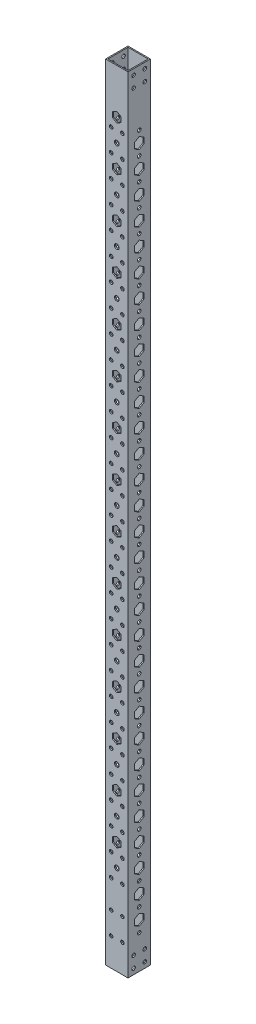
from build123d import *

# Parameters (mm, degrees)
SKETCH_1_W          = 20
SKETCH_1_H          = 20
SKETCH_1_W_2        = 18
SKETCH_1_H_2        = 18
EXTRUDE_1_DEPTH     = 700
SKETCH_3_R          = 1.55
SKETCH_3_R_2        = 2.1
SKETCH_3_R_3        = 1.6
CUT_EXTRUDE_2_DEPTH = 701.357051796
SKETCH_4_R          = 1.6
CUT_EXTRUDE_3_DEPTH = 701.357051796
SKETCH_5_R          = 1.6
CUT_EXTRUDE_4_DEPTH = 701.357051796


with BuildPart() as part:
    # 草图1 → 拉伸-薄壁1 (new body)
    with BuildSketch(Plane(origin=(0, 0, 0), x_dir=(1, 0, 0), z_dir=(0, 1, 0))):
        Rectangle(SKETCH_1_W, SKETCH_1_H)
        Rectangle(SKETCH_1_W_2, SKETCH_1_H_2, mode=Mode.SUBTRACT)
    extrude(amount=EXTRUDE_1_DEPTH)

    # 草图3 → 切除-拉伸2 (cut, through all)
    with BuildSketch(Plane(origin=(0, 0, 10), x_dir=(-1, 0, 0), z_dir=(0, 0, -1))):
        with Locations((-5, 25)):
            Circle(SKETCH_3_R)
        with Locations(Location((-5, 45, 0), (0, 0, 180))):
            Circle(SKETCH_3_R)
        with Locations(Location((5, 25, 0), (0, 0, 180))):
            Circle(SKETCH_3_R)
        with Locations((5, 45)):
            Circle(SKETCH_3_R)
        with Locations((0, 80)):
            Circle(SKETCH_3_R_2)
        with Locations((-5, 70)):
            Circle(SKETCH_3_R_3)
        with Locations(Location((5, 70, 0), (0, 0, 180))):
            Circle(SKETCH_3_R_3)
        with Locations((5, 90)):
            Circle(SKETCH_3_R_3)
        with Locations(Location((-5, 90, 0), (0, 0, 180))):
            Circle(SKETCH_3_R_3)
        with Locations(Location((-5, 130, 0), (0, 0, 180))):
            Circle(SKETCH_3_R_3)
        with Locations((5, 130)):
            Circle(SKETCH_3_R_3)
        with Locations((0, 120)):
            Circle(SKETCH_3_R_2)
        with Locations((-5, 110)):
            Circle(SKETCH_3_R_3)
        with Locations(Location((5, 110, 0), (0, 0, 180))):
            Circle(SKETCH_3_R_3)
        with Locations(Location((-5, 170, 0), (0, 0, 180))):
            Circle(SKETCH_3_R_3)
        with Locations((5, 170)):
            Circle(SKETCH_3_R_3)
        with Locations((0, 160)):
            Circle(SKETCH_3_R_2)
        with Locations((-5, 150)):
            Circle(SKETCH_3_R_3)
        with Locations(Location((5, 150, 0), (0, 0, 180))):
            Circle(SKETCH_3_R_3)
        with Locations(Location((-5, 210, 0), (0, 0, 180))):
            Circle(SKETCH_3_R_3)
        with Locations((5, 210)):
            Circle(SKETCH_3_R_3)
        with Locations((0, 200)):
            Circle(SKETCH_3_R_2)
        with Locations((-5, 190)):
            Circle(SKETCH_3_R_3)
        with Locations(Location((5, 190, 0), (0, 0, 180))):
            Circle(SKETCH_3_R_3)
        with Locations(Location((-5, 250, 0), (0, 0, 180))):
            Circle(SKETCH_3_R_3)
        with Locations((5, 250)):
            Circle(SKETCH_3_R_3)
        with Locations((0, 240)):
            Circle(SKETCH_3_R_2)
        with Locations((-5, 230)):
            Circle(SKETCH_3_R_3)
        with Locations(Location((5, 230, 0), (0, 0, 180))):
            Circle(SKETCH_3_R_3)
        with Locations(Location((-5, 290, 0), (0, 0, 180))):
            Circle(SKETCH_3_R_3)
        with Locations((5, 290)):
            Circle(SKETCH_3_R_3)
        with Locations((0, 280)):
            Circle(SKETCH_3_R_2)
        with Locations((-5, 270)):
            Circle(SKETCH_3_R_3)
        with Locations(Location((5, 270, 0), (0, 0, 180))):
            Circle(SKETCH_3_R_3)
        with Locations(Location((-5, 330, 0), (0, 0, 180))):
            Circle(SKETCH_3_R_3)
        with Locations((5, 330)):
            Circle(SKETCH_3_R_3)
        with Locations((0, 320)):
            Circle(SKETCH_3_R_2)
        with Locations((-5, 310)):
            Circle(SKETCH_3_R_3)
        with Locations(Location((5, 310, 0), (0, 0, 180))):
            Circle(SKETCH_3_R_3)
        with Locations(Location((-5, 370, 0), (0, 0, 180))):
            Circle(SKETCH_3_R_3)
        with Locations((5, 370)):
            Circle(SKETCH_3_R_3)
        with Locations((0, 360)):
            Circle(SKETCH_3_R_2)
        with Locations((-5, 350)):
            Circle(SKETCH_3_R_3)
        with Locations(Location((5, 350, 0), (0, 0, 180))):
            Circle(SKETCH_3_R_3)
        with Locations(Location((-5, 410, 0), (0, 0, 180))):
            Circle(SKETCH_3_R_3)
        with Locations((5, 410)):
            Circle(SKETCH_3_R_3)
        with Locations((0, 400)):
            Circle(SKETCH_3_R_2)
        with Locations((-5, 390)):
            Circle(SKETCH_3_R_3)
        with Locations(Location((5, 390, 0), (0, 0, 180))):
            Circle(SKETCH_3_R_3)
        with Locations(Location((-5, 450, 0), (0, 0, 180))):
            Circle(SKETCH_3_R_3)
        with Locations((5, 450)):
            Circle(SKETCH_3_R_3)
        with Locations((0, 440)):
            Circle(SKETCH_3_R_2)
        with Locations((-5, 430)):
            Circle(SKETCH_3_R_3)
        with Locations(Location((5, 430, 0), (0, 0, 180))):
            Circle(SKETCH_3_R_3)
        with Locations(Location((-5, 490, 0), (0, 0, 180))):
            Circle(SKETCH_3_R_3)
        with Locations((5, 490)):
            Circle(SKETCH_3_R_3)
        with Locations((0, 480)):
            Circle(SKETCH_3_R_2)
        with Locations((-5, 470)):
            Circle(SKETCH_3_R_3)
        with Locations(Location((5, 470, 0), (0, 0, 180))):
            Circle(SKETCH_3_R_3)
        with Locations(Location((-5, 530, 0), (0, 0, 180))):
            Circle(SKETCH_3_R_3)
        with Locations((5, 530)):
            Circle(SKETCH_3_R_3)
        with Locations((0, 520)):
            Circle(SKETCH_3_R_2)
        with Locations((-5, 510)):
            Circle(SKETCH_3_R_3)
        with Locations(Location((5, 510, 0), (0, 0, 180))):
            Circle(SKETCH_3_R_3)
        with Locations(Location((-5, 570, 0), (0, 0, 180))):
            Circle(SKETCH_3_R_3)
        with Locations((5, 570)):
            Circle(SKETCH_3_R_3)
        with Locations((0, 560)):
            Circle(SKETCH_3_R_2)
        with Locations((-5, 550)):
            Circle(SKETCH_3_R_3)
        with Locations(Location((5, 550, 0), (0, 0, 180))):
            Circle(SKETCH_3_R_3)
        with Locations(Location((-5, 610, 0), (0, 0, 180))):
            Circle(SKETCH_3_R_3)
        with Locations((5, 610)):
            Circle(SKETCH_3_R_3)
        with Locations((0, 600)):
            Circle(SKETCH_3_R_2)
        with Locations((-5, 590)):
            Circle(SKETCH_3_R_3)
        with Locations(Location((5, 590, 0), (0, 0, 180))):
            Circle(SKETCH_3_R_3)
        with Locations(Location((-5, 650, 0), (0, 0, 180))):
            Circle(SKETCH_3_R_3)
        with Locations((5, 650)):
            Circle(SKETCH_3_R_3)
        with Locations((0, 640)):
            Circle(SKETCH_3_R_2)
        with Locations((-5, 630)):
            Circle(SKETCH_3_R_3)
        with Locations(Location((5, 630, 0), (0, 0, 180))):
            Circle(SKETCH_3_R_3)
        Polygon((0, 144.5), (-3.897114317, 142.25), (-3.897114317, 137.75), (0, 135.5), (3.897114317, 137.75), (3.897114317, 142.25), align=None)
        Polygon((0, 104.5), (-3.897114317, 102.25), (-3.897114317, 97.75), (0, 95.5), (3.897114317, 97.75), (3.897114317, 102.25), align=None)
        Polygon((0, 184.5), (-3.897114317, 182.25), (-3.897114317, 177.75), (0, 175.5), (3.897114317, 177.75), (3.897114317, 182.25), align=None)
        Polygon((0, 224.5), (-3.897114317, 222.25), (-3.897114317, 217.75), (0, 215.5), (3.897114317, 217.75), (3.897114317, 222.25), align=None)
        Polygon((0, 264.5), (-3.897114317, 262.25), (-3.897114317, 257.75), (0, 255.5), (3.897114317, 257.75), (3.897114317, 262.25), align=None)
        Polygon((0, 304.5), (-3.897114317, 302.25), (-3.897114317, 297.75), (0, 295.5), (3.897114317, 297.75), (3.897114317, 302.25), align=None)
        Polygon((0, 344.5), (-3.897114317, 342.25), (-3.897114317, 337.75), (0, 335.5), (3.897114317, 337.75), (3.897114317, 342.25), align=None)
        Polygon((0, 384.5), (-3.897114317, 382.25), (-3.897114317, 377.75), (0, 375.5), (3.897114317, 377.75), (3.897114317, 382.25), align=None)
        Polygon((0, 424.5), (-3.897114317, 422.25), (-3.897114317, 417.75), (0, 415.5), (3.897114317, 417.75), (3.897114317, 422.25), align=None)
        Polygon((0, 464.5), (-3.897114317, 462.25), (-3.897114317, 457.75), (0, 455.5), (3.897114317, 457.75), (3.897114317, 462.25), align=None)
        Polygon((0, 504.5), (-3.897114317, 502.25), (-3.897114317, 497.75), (0, 495.5), (3.897114317, 497.75), (3.897114317, 502.25), align=None)
        Polygon((0, 544.5), (-3.897114317, 542.25), (-3.897114317, 537.75), (0, 535.5), (3.897114317, 537.75), (3.897114317, 542.25), align=None)
        Polygon((0, 584.5), (-3.897114317, 582.25), (-3.897114317, 577.75), (0, 575.5), (3.897114317, 577.75), (3.897114317, 582.25), align=None)
        Polygon((0, 624.5), (-3.897114317, 622.25), (-3.897114317, 617.75), (0, 615.5), (3.897114317, 617.75), (3.897114317, 622.25), align=None)
        Polygon((0, 664.5), (-3.897114317, 662.25), (-3.897114317, 657.75), (0, 655.5), (3.897114317, 657.75), (3.897114317, 662.25), align=None)
    extrude(amount=CUT_EXTRUDE_2_DEPTH, mode=Mode.SUBTRACT)

    # 草图4 → 切除-拉伸3 (cut, through all)
    with BuildSketch(Plane(origin=(10, 0, 0), x_dir=(0, 0, -1), z_dir=(1, 0, 0))):
        with Locations((-5, 5)):
            Circle(SKETCH_4_R)
        with Locations((-5, 15)):
            Circle(SKETCH_4_R)
        with Locations((5, 5)):
            Circle(SKETCH_4_R)
        with Locations((5, 15)):
            Circle(SKETCH_4_R)
        with Locations((5, 685)):
            Circle(SKETCH_4_R)
        with Locations((5, 695)):
            Circle(SKETCH_4_R)
        with Locations((-5, 685)):
            Circle(SKETCH_4_R)
        with Locations((-5, 695)):
            Circle(SKETCH_4_R)
    extrude(amount=-CUT_EXTRUDE_3_DEPTH, mode=Mode.SUBTRACT)

    # 草图5 → 切除-拉伸4 (cut, through all)
    with BuildSketch(Plane(origin=(10, 0, 0), x_dir=(0, 0, -1), z_dir=(1, 0, 0))):
        with Locations((0, 50)):
            Circle(SKETCH_5_R)
        with Locations((0, 70)):
            Circle(SKETCH_5_R)
        with Locations((0, 90)):
            Circle(SKETCH_5_R)
        with Locations((0, 110)):
            Circle(SKETCH_5_R)
        with Locations((0, 130)):
            Circle(SKETCH_5_R)
        with Locations((0, 150)):
            Circle(SKETCH_5_R)
        with Locations((0, 170)):
            Circle(SKETCH_5_R)
        with Locations((0, 190)):
            Circle(SKETCH_5_R)
        with Locations((0, 210)):
            Circle(SKETCH_5_R)
        with Locations((0, 230)):
            Circle(SKETCH_5_R)
        with Locations((0, 250)):
            Circle(SKETCH_5_R)
        with Locations((0, 270)):
            Circle(SKETCH_5_R)
        with Locations((0, 290)):
            Circle(SKETCH_5_R)
        with Locations((0, 310)):
            Circle(SKETCH_5_R)
        with Locations((0, 330)):
            Circle(SKETCH_5_R)
        with Locations((0, 350)):
            Circle(SKETCH_5_R)
        with Locations((0, 370)):
            Circle(SKETCH_5_R)
        with Locations((0, 390)):
            Circle(SKETCH_5_R)
        with Locations((0, 410)):
            Circle(SKETCH_5_R)
        with Locations((0, 430)):
            Circle(SKETCH_5_R)
        with Locations((0, 450)):
            Circle(SKETCH_5_R)
        with Locations((0, 470)):
            Circle(SKETCH_5_R)
        with Locations((0, 490)):
            Circle(SKETCH_5_R)
        with Locations((0, 510)):
            Circle(SKETCH_5_R)
        with Locations((0, 530)):
            Circle(SKETCH_5_R)
        with Locations((0, 550)):
            Circle(SKETCH_5_R)
        with Locations((0, 570)):
            Circle(SKETCH_5_R)
        with Locations((0, 590)):
            Circle(SKETCH_5_R)
        with Locations((0, 610)):
            Circle(SKETCH_5_R)
        with Locations((0, 630)):
            Circle(SKETCH_5_R)
        with Locations((0, 650)):
            Circle(SKETCH_5_R)
        with Locations((0, 30)):
            Circle(SKETCH_5_R)
        Polygon((0, 65), (-4.330127019, 62.5), (-4.330127019, 57.5), (0, 55), (4.330127019, 57.5), (4.330127019, 62.5), align=None)
        Polygon((0, 45), (-4.330127019, 42.5), (-4.330127019, 37.5), (0, 35), (4.330127019, 37.5), (4.330127019, 42.5), align=None)
        Polygon((0, 85), (-4.330127019, 82.5), (-4.330127019, 77.5), (0, 75), (4.330127019, 77.5), (4.330127019, 82.5), align=None)
        Polygon((0, 105), (-4.330127019, 102.5), (-4.330127019, 97.5), (0, 95), (4.330127019, 97.5), (4.330127019, 102.5), align=None)
        Polygon((0, 125), (-4.330127019, 122.5), (-4.330127019, 117.5), (0, 115), (4.330127019, 117.5), (4.330127019, 122.5), align=None)
        Polygon((0, 145), (-4.330127019, 142.5), (-4.330127019, 137.5), (0, 135), (4.330127019, 137.5), (4.330127019, 142.5), align=None)
        Polygon((0, 165), (-4.330127019, 162.5), (-4.330127019, 157.5), (0, 155), (4.330127019, 157.5), (4.330127019, 162.5), align=None)
        Polygon((0, 185), (-4.330127019, 182.5), (-4.330127019, 177.5), (0, 175), (4.330127019, 177.5), (4.330127019, 182.5), align=None)
        Polygon((0, 205), (-4.330127019, 202.5), (-4.330127019, 197.5), (0, 195), (4.330127019, 197.5), (4.330127019, 202.5), align=None)
        Polygon((0, 225), (-4.330127019, 222.5), (-4.330127019, 217.5), (0, 215), (4.330127019, 217.5), (4.330127019, 222.5), align=None)
        Polygon((0, 245), (-4.330127019, 242.5), (-4.330127019, 237.5), (0, 235), (4.330127019, 237.5), (4.330127019, 242.5), align=None)
        Polygon((0, 265), (-4.330127019, 262.5), (-4.330127019, 257.5), (0, 255), (4.330127019, 257.5), (4.330127019, 262.5), align=None)
        Polygon((0, 285), (-4.330127019, 282.5), (-4.330127019, 277.5), (0, 275), (4.330127019, 277.5), (4.330127019, 282.5), align=None)
        Polygon((0, 305), (-4.330127019, 302.5), (-4.330127019, 297.5), (0, 295), (4.330127019, 297.5), (4.330127019, 302.5), align=None)
        Polygon((0, 325), (-4.330127019, 322.5), (-4.330127019, 317.5), (0, 315), (4.330127019, 317.5), (4.330127019, 322.5), align=None)
        Polygon((0, 345), (-4.330127019, 342.5), (-4.330127019, 337.5), (0, 335), (4.330127019, 337.5), (4.330127019, 342.5), align=None)
        Polygon((0, 365), (-4.330127019, 362.5), (-4.330127019, 357.5), (0, 355), (4.330127019, 357.5), (4.330127019, 362.5), align=None)
        Polygon((0, 385), (-4.330127019, 382.5), (-4.330127019, 377.5), (0, 375), (4.330127019, 377.5), (4.330127019, 382.5), align=None)
        Polygon((0, 405), (-4.330127019, 402.5), (-4.330127019, 397.5), (0, 395), (4.330127019, 397.5), (4.330127019, 402.5), align=None)
        Polygon((0, 425), (-4.330127019, 422.5), (-4.330127019, 417.5), (0, 415), (4.330127019, 417.5), (4.330127019, 422.5), align=None)
        Polygon((0, 445), (-4.330127019, 442.5), (-4.330127019, 437.5), (0, 435), (4.330127019, 437.5), (4.330127019, 442.5), align=None)
        Polygon((0, 465), (-4.330127019, 462.5), (-4.330127019, 457.5), (0, 455), (4.330127019, 457.5), (4.330127019, 462.5), align=None)
        Polygon((0, 485), (-4.330127019, 482.5), (-4.330127019, 477.5), (0, 475), (4.330127019, 477.5), (4.330127019, 482.5), align=None)
        Polygon((0, 505), (-4.330127019, 502.5), (-4.330127019, 497.5), (0, 495), (4.330127019, 497.5), (4.330127019, 502.5), align=None)
        Polygon((0, 525), (-4.330127019, 522.5), (-4.330127019, 517.5), (0, 515), (4.330127019, 517.5), (4.330127019, 522.5), align=None)
        Polygon((0, 545), (-4.330127019, 542.5), (-4.330127019, 537.5), (0, 535), (4.330127019, 537.5), (4.330127019, 542.5), align=None)
        Polygon((0, 565), (-4.330127019, 562.5), (-4.330127019, 557.5), (0, 555), (4.330127019, 557.5), (4.330127019, 562.5), align=None)
        Polygon((0, 585), (-4.330127019, 582.5), (-4.330127019, 577.5), (0, 575), (4.330127019, 577.5), (4.330127019, 582.5), align=None)
        Polygon((0, 605), (-4.330127019, 602.5), (-4.330127019, 597.5), (0, 595), (4.330127019, 597.5), (4.330127019, 602.5), align=None)
        Polygon((0, 625), (-4.330127019, 622.5), (-4.330127019, 617.5), (0, 615), (4.330127019, 617.5), (4.330127019, 622.5), align=None)
        Polygon((0, 645), (-4.330127019, 642.5), (-4.330127019, 637.5), (0, 635), (4.330127019, 637.5), (4.330127019, 642.5), align=None)
    extrude(amount=-CUT_EXTRUDE_4_DEPTH, mode=Mode.SUBTRACT)


solid = part.part
